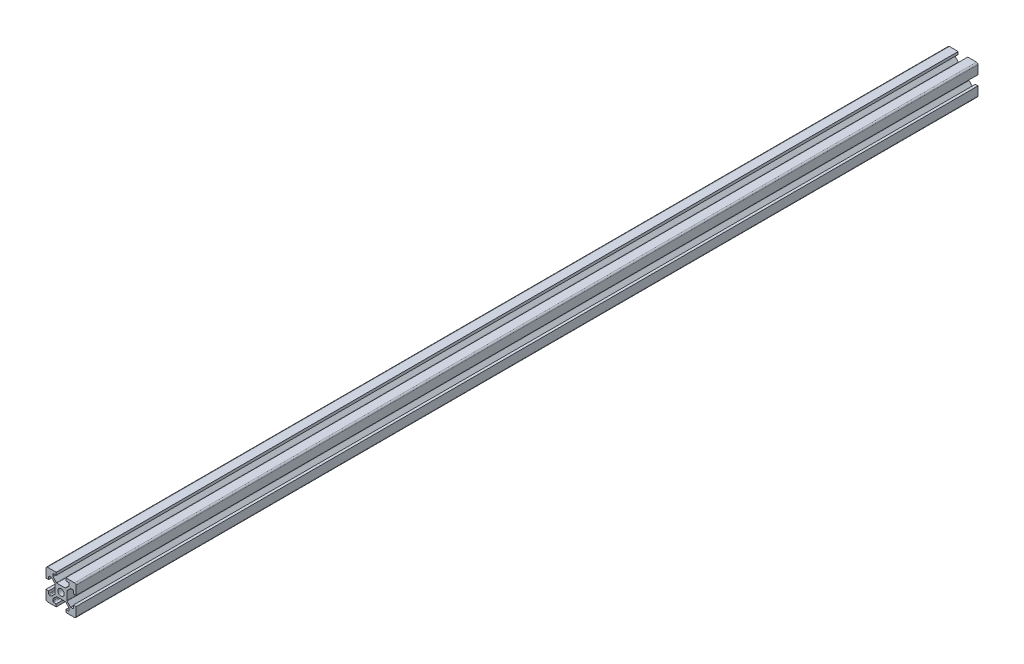
from build123d import *

# Parameters (mm, degrees)
SKETCH1_R           = 2.1
BOSS_EXTRUDE1_DEPTH = 600
FILLET1_R           = 1
FILLET2_R           = 0.5
FILLET3_R           = 0.5
FILLET4_R           = 0.5
FILLET5_R           = 0.5


with BuildPart() as part:
    # Sketch1 → Boss-Extrude1 (new body)
    with BuildSketch(Plane.XY):
        Polygon((13.2, 0), (13.2, 1.8), (15.45, 1.8), (15.45, 3.6), (12.95, 6.1), (7.05, 6.1), (4.55, 3.6), (4.55, 1.8), (6.8, 1.8), (6.8, 0), (0, 0), (0, 6.8), (1.8, 6.8), (1.8, 4.55), (3.6, 4.55), (6.1, 7.05), (6.1, 12.95), (3.6, 15.45), (1.8, 15.45), (1.8, 13.2), (0, 13.2), (0, 20), (6.8, 20), (6.8, 18.2), (4.55, 18.2), (4.55, 16.4), (7.05, 13.9), (12.95, 13.9), (15.45, 16.4), (15.45, 18.2), (13.2, 18.2), (13.2, 20), (20, 20), (20, 13.2), (18.2, 13.2), (18.2, 15.45), (16.4, 15.45), (13.9, 12.95), (13.9, 7.05), (16.4, 4.55), (18.2, 4.55), (18.2, 6.8), (20, 6.8), (20, 0), align=None)
        with Locations((10, 10)):
            Circle(SKETCH1_R, mode=Mode.SUBTRACT)
    extrude(amount=BOSS_EXTRUDE1_DEPTH)

    # Fillet1
    fillet1_edges = [part.edges().sort_by_distance(p)[0] for p in [
        (0, 0, 300),
        (0, 20, 300),
        (20, 20, 300),
        (20, 0, 300),
    ]]
    fillet(fillet1_edges, radius=FILLET1_R)

    # Fillet2
    fillet2_edges = [part.edges().sort_by_distance(p)[0] for p in [
        (4.55, 18.2, 300),
        (4.55, 16.4, 300),
        (7.05, 13.9, 300),
        (12.95, 13.9, 300),
        (15.45, 16.4, 300),
        (15.45, 18.2, 300),
    ]]
    fillet(fillet2_edges, radius=FILLET2_R)

    # Fillet3
    fillet3_edges = [part.edges().sort_by_distance(p)[0] for p in [
        (18.2, 15.45, 300),
        (16.4, 15.45, 300),
        (13.9, 12.95, 300),
        (13.9, 7.05, 300),
        (16.4, 4.55, 300),
        (18.2, 4.55, 300),
    ]]
    fillet(fillet3_edges, radius=FILLET3_R)

    # Fillet4
    fillet4_edges = [part.edges().sort_by_distance(p)[0] for p in [
        (1.8, 4.55, 300),
        (3.6, 4.55, 300),
        (6.1, 7.05, 300),
        (6.1, 12.95, 300),
        (3.6, 15.45, 300),
        (1.8, 15.45, 300),
    ]]
    fillet(fillet4_edges, radius=FILLET4_R)

    # Fillet5
    fillet5_edges = [part.edges().sort_by_distance(p)[0] for p in [
        (15.45, 1.8, 300),
        (15.45, 3.6, 300),
        (12.95, 6.1, 300),
        (7.05, 6.1, 300),
        (4.55, 3.6, 300),
        (4.55, 1.8, 300),
    ]]
    fillet(fillet5_edges, radius=FILLET5_R)


solid = part.part
